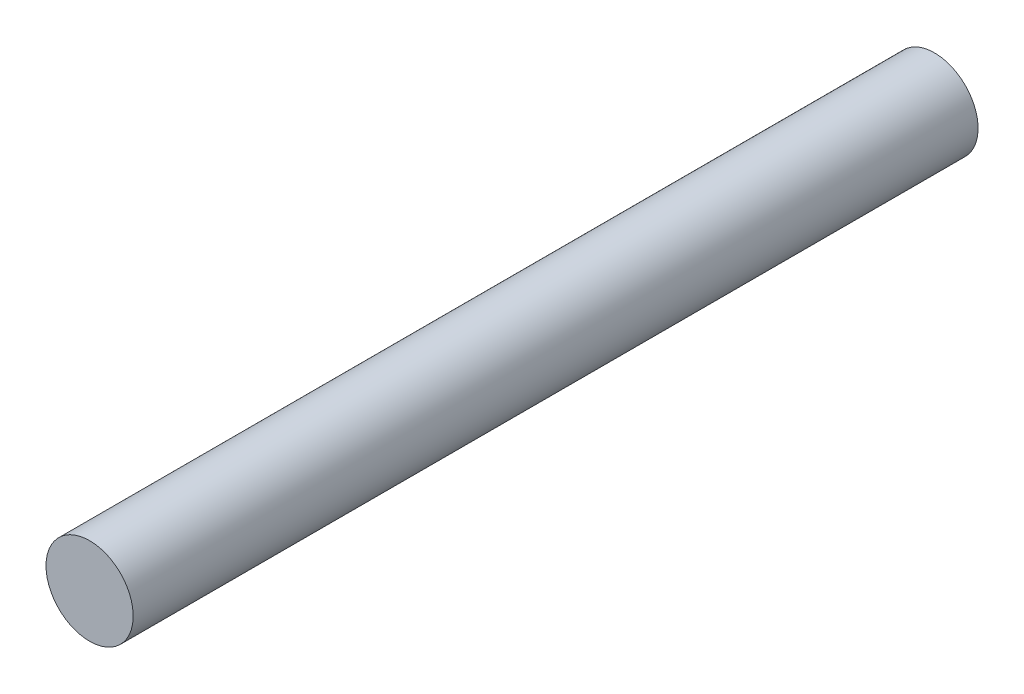
from build123d import *

# Parameters (mm, degrees)
SKETCH1_R           = 6.35
BOSS_EXTRUDE1_DEPTH = 123.063


with BuildPart() as part:
    # Sketch1 → Boss-Extrude1 (new body)
    with BuildSketch(Plane.XY):
        with Locations(Location((0, 0, 0), (0, 0, 180))):
            Circle(SKETCH1_R)
    extrude(amount=BOSS_EXTRUDE1_DEPTH)


solid = part.part
